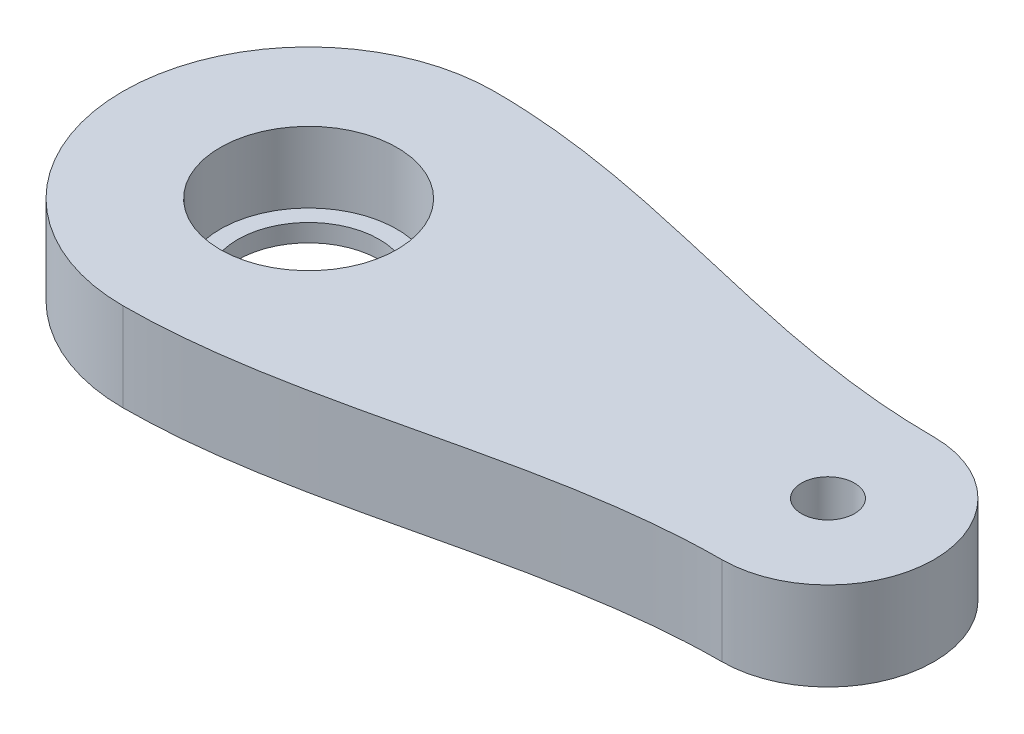
from build123d import *

# Parameters (mm, degrees)
BOSS_EXTRUDE1_DEPTH = 5
SKETCH2_R           = 1.5
SKETCH2_R_2         = 5
CUT_EXTRUDE1_DEPTH  = 4
SKETCH3_R           = 4
CUT_EXTRUDE2_DEPTH  = 10
CUT_EXTRUDE3_START  = -10
SKETCH4_R           = 1.5
CUT_EXTRUDE3_DEPTH  = 10


with BuildPart() as part:
    # Sketch1 → Boss-Extrude1 (new body)
    with BuildSketch(Plane(origin=(0, 0, 0), x_dir=(1, 0, 0), z_dir=(0, 1, 0))):
        with BuildLine():
            ThreePointArc((0, -6), (6, 0), (0, 6))
            add(Edge.make_bspline(
                [(-29.37, 10.5), (-19.469048306, 10.5), (-10.126942608, 6), (0, 6)],
                knots=[0, 0, 0, 0, 1, 1, 1, 1], degree=3))
            ThreePointArc((-29.37, 10.5), (-39.87, 0), (-29.37, -10.5))
            add(Edge.make_bspline(
                [(-29.37, -10.5), (-19.469048306, -10.5), (-10.126942608, -6), (0, -6)],
                knots=[0, 0, 0, 0, 1, 1, 1, 1], degree=3))
        make_face()
    extrude(amount=BOSS_EXTRUDE1_DEPTH)

    # Sketch2 → Cut-Extrude1 (cut)
    with BuildSketch(Plane(origin=(0, 5, 0), x_dir=(1, 0, 0), z_dir=(0, 1, 0))):
        with Locations(Location((0, 0, 0), (0, 0, 270))):
            Circle(SKETCH2_R)
        with Locations(Location((-29.37, 0, 0), (0, 0, 270))):
            Circle(SKETCH2_R_2)
    extrude(amount=-CUT_EXTRUDE1_DEPTH, mode=Mode.SUBTRACT)

    # Sketch3 → Cut-Extrude2 (cut)
    with BuildSketch(Plane.XZ):
        with Locations(Location((-29.37, 0, 0), (0, 0, 270))):
            Circle(SKETCH3_R)
    extrude(amount=-CUT_EXTRUDE2_DEPTH, mode=Mode.SUBTRACT)

    # Sketch4 → Cut-Extrude3 (cut)
    with BuildSketch(Plane.XZ.offset(CUT_EXTRUDE3_START)):
        with Locations(Location((0, 0, 0), (0, 0, 90))):
            Circle(SKETCH4_R)
    extrude(amount=CUT_EXTRUDE3_DEPTH, mode=Mode.SUBTRACT)


solid = part.part
